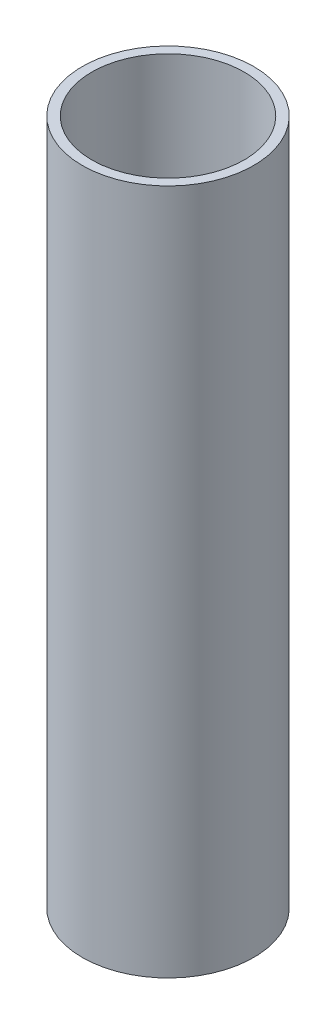
from build123d import *

# Parameters (mm, degrees)
SKETCH1_R           = 57.15
SKETCH1_R_2         = 50.8
BOSS_EXTRUDE1_DEPTH = 457.2


with BuildPart() as part:
    # Sketch1 → Boss-Extrude1 (new body)
    with BuildSketch(Plane(origin=(0, 0, 0), x_dir=(1, 0, 0), z_dir=(0, 1, 0))):
        with Locations(Location((0, 0, 0), (0, 0, 270))):
            Circle(SKETCH1_R)
        with Locations(Location((0, 0, 0), (0, 0, 270))):
            Circle(SKETCH1_R_2, mode=Mode.SUBTRACT)
    extrude(amount=BOSS_EXTRUDE1_DEPTH)


solid = part.part
